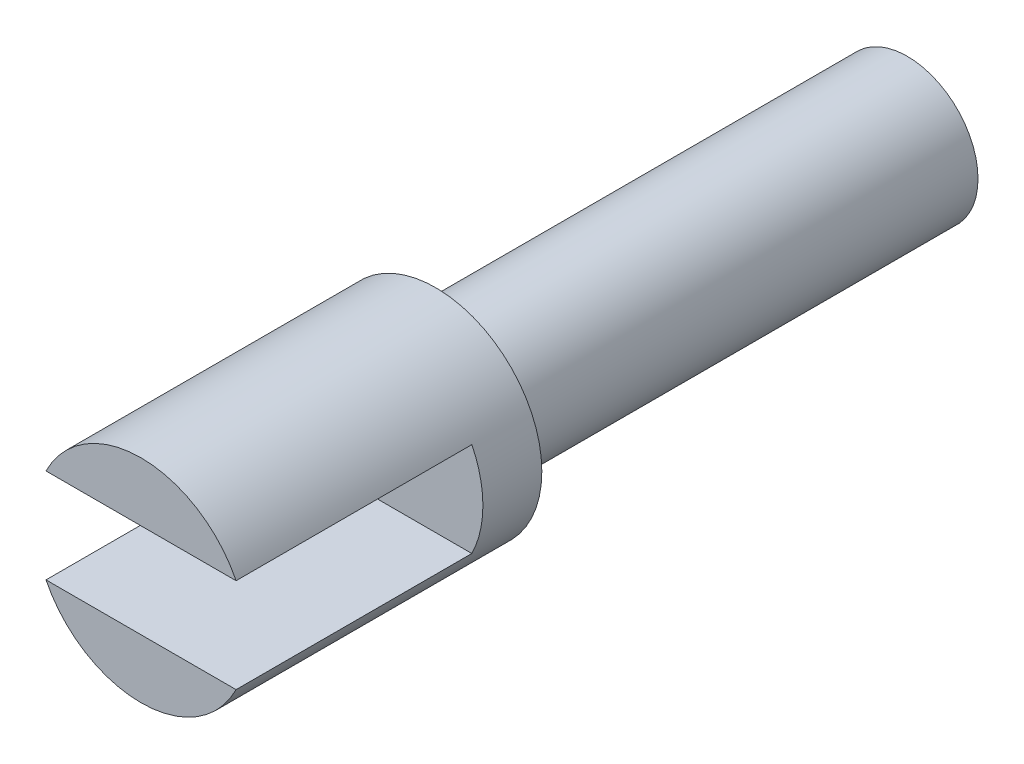
from build123d import *

# Parameters (mm, degrees)
SZKIC1_W                   = 6
SZKIC1_H                   = 40
SZKIC2_W                   = 18
SZKIC2_H                   = 8
WYTNIJ_WYCI_GNI_CIE1_DEPTH = 20


with BuildPart() as part:
    # Szkic1 → Obrót1 (revolve)
    with BuildSketch(Plane(origin=(0, 0, 0), x_dir=(1, 0, 0), z_dir=(0, 1, 0))):
        with Locations((3, 20)):
            Rectangle(SZKIC1_W, SZKIC1_H)
        Polygon((0, 0), (0, -25), (9, -25), (9, 0), (6, 0), align=None)
    revolve(axis=Axis((0, 0, 44.409951059), (0, 0, -1)))

    # Szkic2 → Wytnij-wyciągnięcie1 (cut)
    with BuildSketch(Plane.XY.offset(25)):
        Rectangle(SZKIC2_W, SZKIC2_H)
    extrude(amount=-WYTNIJ_WYCI_GNI_CIE1_DEPTH, mode=Mode.SUBTRACT)


solid = part.part
